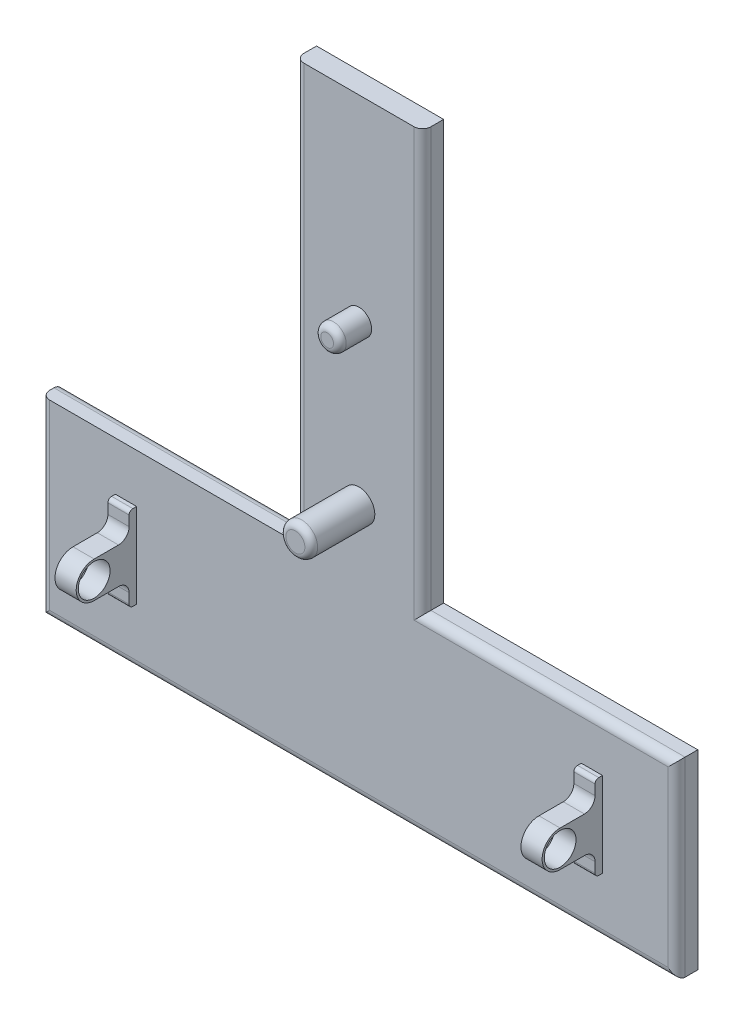
from build123d import *

# Parameters (mm, degrees)
BOSS_EXTRUDE1_DEPTH = 10
SKETCH1_3_R         = 6
BOSS_EXTRUDE2_DEPTH = 25
SKETCH1_4_R         = 7.5
BOSS_EXTRUDE3_DEPTH = 40
FILLET1_R           = 3
FILLET3_R           = 4
BOSS_EXTRUDE4_START = 105
SKETCH2_R           = 7.5
BOSS_EXTRUDE4_DEPTH = 10
BOSS_EXTRUDE5_START = -115
SKETCH2_2_R         = 7.5
BOSS_EXTRUDE5_DEPTH = 10


with BuildPart() as part:
    # Sketch1 → Boss-Extrude1 (new body)
    with BuildSketch(Plane.XY):
        Polygon((-150, 0), (150, 0), (150, 90), (30, 90), (30, 287.77), (-30, 287.77), (-30, 90), (-150, 90), align=None)
    extrude(amount=BOSS_EXTRUDE1_DEPTH)

    # Sketch1<3> → Boss-Extrude2 (add)
    with BuildSketch(Plane.XY):
        with Locations((0, 195)):
            Circle(SKETCH1_3_R)
    extrude(amount=BOSS_EXTRUDE2_DEPTH)

    # Sketch1<4> → Boss-Extrude3 (add)
    with BuildSketch(Plane.XY):
        with Locations((0, 120)):
            Circle(SKETCH1_4_R)
    extrude(amount=BOSS_EXTRUDE3_DEPTH)

    # Fillet1
    fillet1_edges = [part.edges().sort_by_distance(p)[0] for p in [
        (-7.5, 120, 40),
        (-6, 195, 25),
    ]]
    fillet(fillet1_edges, radius=FILLET1_R)

    # Fillet3
    fillet3_edges = [part.edges().sort_by_distance(p)[0] for p in [
        (-150, 45, 10),
        (0, 0, 10),
        (150, 45, 10),
        (90, 90, 10),
        (30, 188.885, 10),
        (-30, 188.885, 10),
        (-90, 90, 0),
    ]]
    fillet(fillet3_edges, radius=FILLET3_R)

    # Sketch2 → Boss-Extrude4 (add)
    with BuildSketch(Plane(origin=(0, 0, 0), x_dir=(0, 0, -1), z_dir=(1, 0, 0)).offset(BOSS_EXTRUDE4_START)):
        with BuildLine():
            Line((-10, 67), (-10, 27))
            Line((-10, 27), (-11.76, 27))
            ThreePointArc((-11.76, 27), (-13.004507935, 27.515492065), (-13.52, 28.76))
            Line((-13.52, 28.76), (-13.52, 33.5))
            ThreePointArc((-13.52, 33.5), (-14.984466094, 37.035533906), (-18.52, 38.5))
            Line((-18.52, 38.5), (-30, 38.5))
            ThreePointArc((-30, 38.5), (-38.5, 47), (-30, 55.5))
            Line((-30, 55.5), (-18.52, 55.5))
            ThreePointArc((-18.52, 55.5), (-14.984466094, 56.964466094), (-13.52, 60.5))
            Line((-13.52, 60.5), (-13.52, 65.24))
            ThreePointArc((-13.52, 65.24), (-13.004507935, 66.484507935), (-11.76, 67))
            Line((-11.76, 67), (-10, 67))
        make_face()
        with Locations((-30, 47)):
            Circle(SKETCH2_R, mode=Mode.SUBTRACT)
    extrude(amount=BOSS_EXTRUDE4_DEPTH)

    # Sketch2<2> → Boss-Extrude5 (add)
    with BuildSketch(Plane(origin=(0, 0, 0), x_dir=(0, 0, -1), z_dir=(1, 0, 0)).offset(BOSS_EXTRUDE5_START)):
        with BuildLine():
            Line((-10, 67), (-10, 27))
            Line((-10, 27), (-11.76, 27))
            ThreePointArc((-11.76, 27), (-13.004507935, 27.515492065), (-13.52, 28.76))
            Line((-13.52, 28.76), (-13.52, 33.5))
            ThreePointArc((-13.52, 33.5), (-14.984466094, 37.035533906), (-18.52, 38.5))
            Line((-18.52, 38.5), (-30, 38.5))
            ThreePointArc((-30, 38.5), (-38.5, 47), (-30, 55.5))
            Line((-30, 55.5), (-18.52, 55.5))
            ThreePointArc((-18.52, 55.5), (-14.984466094, 56.964466094), (-13.52, 60.5))
            Line((-13.52, 60.5), (-13.52, 65.24))
            ThreePointArc((-13.52, 65.24), (-13.004507935, 66.484507935), (-11.76, 67))
            Line((-11.76, 67), (-10, 67))
        make_face()
        with Locations((-30, 47)):
            Circle(SKETCH2_2_R, mode=Mode.SUBTRACT)
    extrude(amount=BOSS_EXTRUDE5_DEPTH)


solid = part.part
